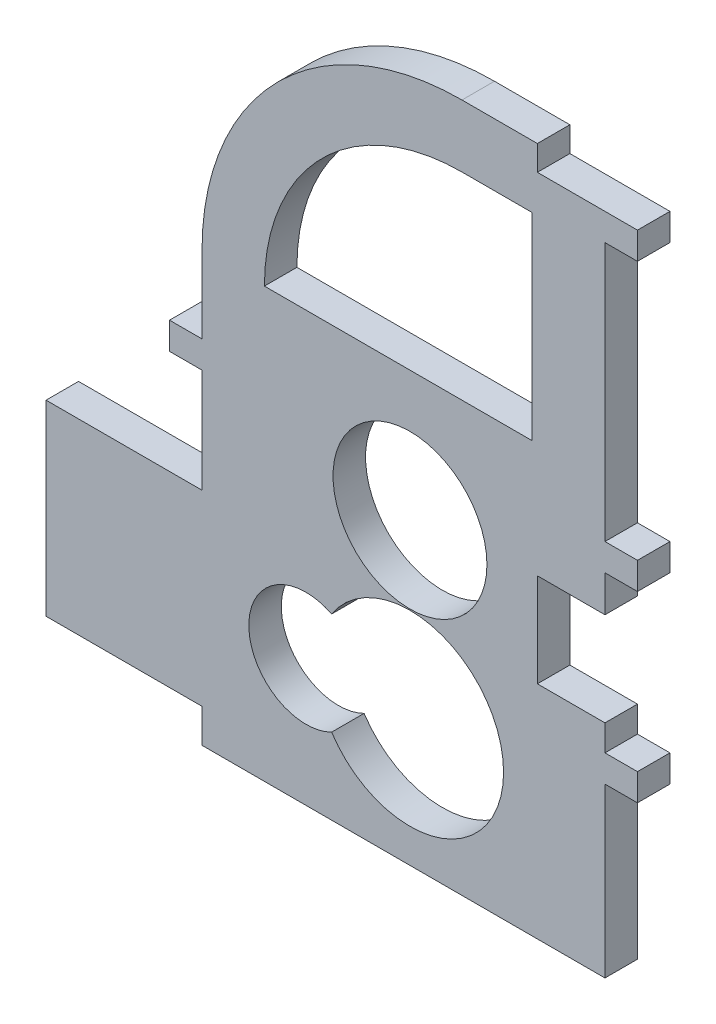
from build123d import *

# Parameters (mm, degrees)
SKETCH1_R           = 3.7592
BOSS_EXTRUDE1_DEPTH = 1.5875
CUT_EXTRUDE1_REACH  = 28.107
SKETCH2_W           = 3.302
SKETCH2_H           = 4.572
SKETCH2_H_2         = 3.7592


with BuildPart() as part:
    # Sketch1 → Boss-Extrude1 (new body)
    with BuildSketch(Plane.XY):
        with BuildLine():
            Line((11.112499999, 17.8308), (9.524999999, 17.8308))
            Line((9.524999999, 17.8308), (9.524999999, 19.05))
            Line((9.524999999, 19.05), (2.54, 19.05))
            ThreePointArc((2.54, 19.05), (-6.440256121, 15.330256121), (-10.16, 6.35))
            Line((-10.16, 6.35), (-10.16, 2.5908))
            Line((-10.160000001, 2.5908), (-11.747500001, 2.5908))
            Line((-11.747500001, 2.5908), (-11.747500001, 1.27))
            Line((-11.747500001, 1.27), (-10.160000001, 1.27))
            Line((-10.160000001, 1.27), (-10.160000001, -3.81))
            Line((-10.160000001, -3.81), (-17.78, -3.81))
            Line((-17.78, -3.81), (-17.78, -12.954))
            Line((-17.78, -12.954), (-10.16, -12.954))
            Line((-10.160000001, -12.954), (-10.160000001, -14.605))
            Line((-10.160000001, -14.605), (9.524999999, -14.605))
            Line((9.524999999, -14.605), (9.524999999, -6.4008))
            Line((9.524999999, -6.4008), (11.112499999, -6.4008))
            Line((11.112499999, -6.4008), (11.112499999, -5.08))
            Line((11.112499999, -5.08), (9.524999999, -5.08))
            Line((9.524999999, -5.08), (9.524999999, 2.54))
            Line((9.525, 2.54), (11.1125, 2.54))
            Line((11.1125, 2.54), (11.1125, 3.8608))
            Line((11.1125, 3.8608), (9.525, 3.8608))
            Line((9.524999999, 3.8608), (9.524999999, 16.51))
            Line((9.524999999, 16.51), (11.112499999, 16.51))
            Line((11.112499999, 16.51), (11.112499999, 17.8308))
        make_face()
        with BuildLine():
            ThreePointArc((-7.112, 6.35), (-4.284994652, 13.174994652), (2.54, 16.002))
            Line((2.54, 16.002), (5.968999999, 16.002))
            Line((5.968999999, 16.002), (5.968999999, 6.35))
            Line((5.968999999, 6.35), (-7.112, 6.35))
        make_face(mode=Mode.SUBTRACT)
        with BuildLine():
            ThreePointArc((-3.82905, -5.883688551), (4.572, -8.382), (-3.82905, -10.880311449))
            ThreePointArc((-3.82905, -10.880311449), (-7.874, -8.382), (-3.82905, -5.883688551))
        make_face(mode=Mode.SUBTRACT)
        Circle(SKETCH1_R, mode=Mode.SUBTRACT)
    extrude(amount=BOSS_EXTRUDE1_DEPTH)

    # Sketch2 → Cut-Extrude1 (cut, up to next)
    with BuildSketch(Plane.XY.offset(1.5875), mode=Mode.PRIVATE) as cut_extrude1_sk1:
        with Locations((7.873999999, -1.524)):
            Rectangle(SKETCH2_W, SKETCH2_H)
    cut_extrude1_tool1 = extrude(cut_extrude1_sk1.sketch, amount=-CUT_EXTRUDE1_REACH, mode=Mode.PRIVATE) & part.part
    # Sketch2 → Cut-Extrude1 (cut, up to next)
    with BuildSketch(Plane.XY.offset(1.5875), mode=Mode.PRIVATE) as cut_extrude1_sk2:
        with Locations((7.873999999, 19.7104)):
            Rectangle(SKETCH2_W, SKETCH2_H_2)
    cut_extrude1_tool2 = extrude(cut_extrude1_sk2.sketch, amount=-CUT_EXTRUDE1_REACH, mode=Mode.PRIVATE) & part.part
    add(cut_extrude1_tool1.solids().sort_by_distance((7.874, -1.524, 1.5875))[0], mode=Mode.SUBTRACT)
    add(cut_extrude1_tool2.solids().sort_by_distance((7.874, 19.7104, 1.5875))[0], mode=Mode.SUBTRACT)


solid = part.part
